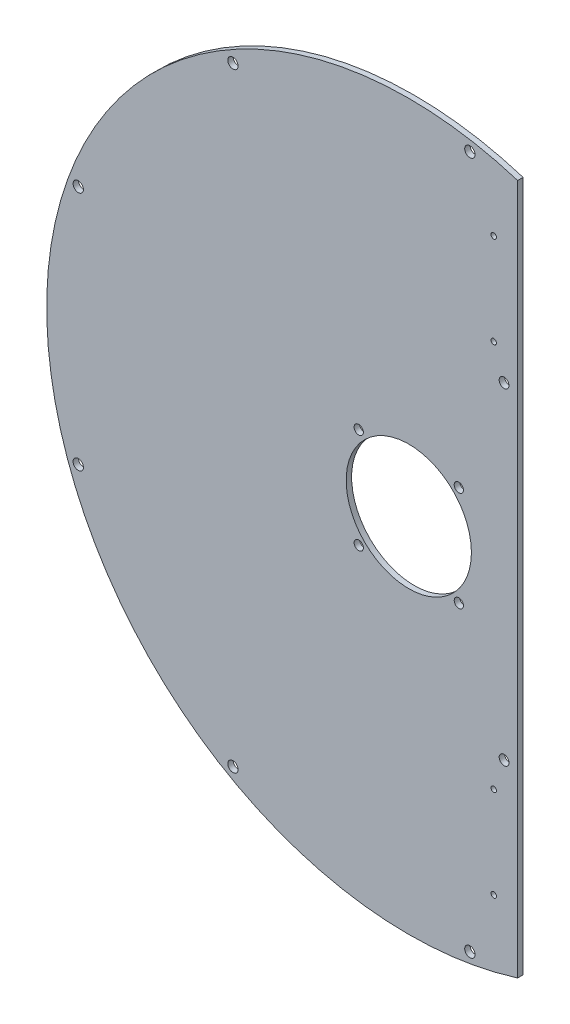
from build123d import *

# Parameters (mm, degrees)
SKIZZE1_R                       = 4.75
LINEAR_AUSTRAGEN1_DEPTH         = 5
SKIZZE10_R                      = 57.5
SCHNITT_LINEAR_AUSTRAGEN3_DEPTH = 471.252591699
SKIZZE15_R                      = 4.25
SCHNITT_LINEAR_AUSTRAGEN5_DEPTH = 471.252591699
M6_GEWINDEBOHRUNG1_D            = 5
SKIZZE17_R                      = 4.5
SCHNITT_LINEAR_AUSTRAGEN7_DEPTH = 471.252591699


with BuildPart() as part:
    # Skizze1 → Linear austragen1 (new body)
    with BuildSketch(Plane.XY):
        with BuildLine():
            Line((100, 317.106054814), (100, -317.106054814))
            ThreePointArc((100, -317.106054814), (-332.5, 0), (100, 317.106054814))
        make_face()
        with Locations((56.088361386, 318.092904223)):
            Circle(SKIZZE1_R, mode=Mode.SUBTRACT)
        with Locations((56.088361386, -318.092904223)):
            Circle(SKIZZE1_R, mode=Mode.SUBTRACT)
        with Locations((-161.5, -279.726205422)):
            Circle(SKIZZE1_R, mode=Mode.SUBTRACT)
        with Locations((-303.520716514, -110.472506294)):
            Circle(SKIZZE1_R, mode=Mode.SUBTRACT)
        with Locations((-303.520716514, 110.472506294)):
            Circle(SKIZZE1_R, mode=Mode.SUBTRACT)
        with Locations((-161.5, 279.726205422)):
            Circle(SKIZZE1_R, mode=Mode.SUBTRACT)
    extrude(amount=LINEAR_AUSTRAGEN1_DEPTH)

    # Skizze10 → Schnitt-Linear austragen3 (cut, through all)
    with BuildSketch(Plane.XY.offset(5)):
        Circle(SKIZZE10_R)
    extrude(amount=-SCHNITT_LINEAR_AUSTRAGEN3_DEPTH, mode=Mode.SUBTRACT)

    # Skizze15 → Schnitt-Linear austragen5 (cut, through all)
    with BuildSketch(Plane.XY.offset(5)):
        with Locations((-45.961940777, 45.961940777)):
            Circle(SKIZZE15_R)
        with Locations((45.961940777, 45.961940777)):
            Circle(SKIZZE15_R)
        with Locations((45.961940777, -45.961940777)):
            Circle(SKIZZE15_R)
        with Locations((-45.961940777, -45.961940777)):
            Circle(SKIZZE15_R)
    extrude(amount=-SCHNITT_LINEAR_AUSTRAGEN5_DEPTH, mode=Mode.SUBTRACT)

    # M6 Gewindebohrung1 (through all)
    with Locations(Plane.XY.offset(5)):
        with Locations((78, -262), (78, -178), (78, 178), (78, 262)):
            Hole(M6_GEWINDEBOHRUNG1_D / 2)

    # Skizze17 → Schnitt-Linear austragen7 (cut, through all)
    with BuildSketch(Plane.XY.offset(5)):
        with Locations((87.5, -150)):
            Circle(SKIZZE17_R)
        with Locations((87.5, 150)):
            Circle(SKIZZE17_R)
    extrude(amount=-SCHNITT_LINEAR_AUSTRAGEN7_DEPTH, mode=Mode.SUBTRACT)


solid = part.part
